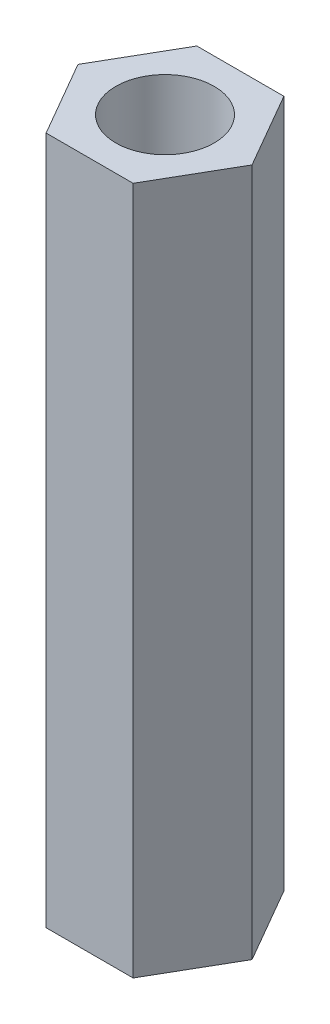
from build123d import *

# Parameters (mm, degrees)
EXTRUDE_1_DEPTH     = 21
SKETCH_4_R          = 1.5
CUT_EXTRUDE_1_DEPTH = 21


with BuildPart() as part:
    # 草图1 → 凸台-拉伸1 (new body)
    with BuildSketch(Plane(origin=(0, 0, 0), x_dir=(1, 0, 0), z_dir=(0, 1, 0))):
        Polygon((-1.327905619, 2.3), (-2.655811238, 0), (-1.327905619, -2.3), (1.327905619, -2.3), (2.655811238, 0), (1.327905619, 2.3), align=None)
    extrude(amount=EXTRUDE_1_DEPTH)

    # 草图4 → 切除-拉伸1 (cut)
    with BuildSketch(Plane.XZ):
        with Locations(Location((0, 0, 0), (0, 0, 270))):
            Circle(SKETCH_4_R)
    extrude(amount=-CUT_EXTRUDE_1_DEPTH, mode=Mode.SUBTRACT)


solid = part.part
